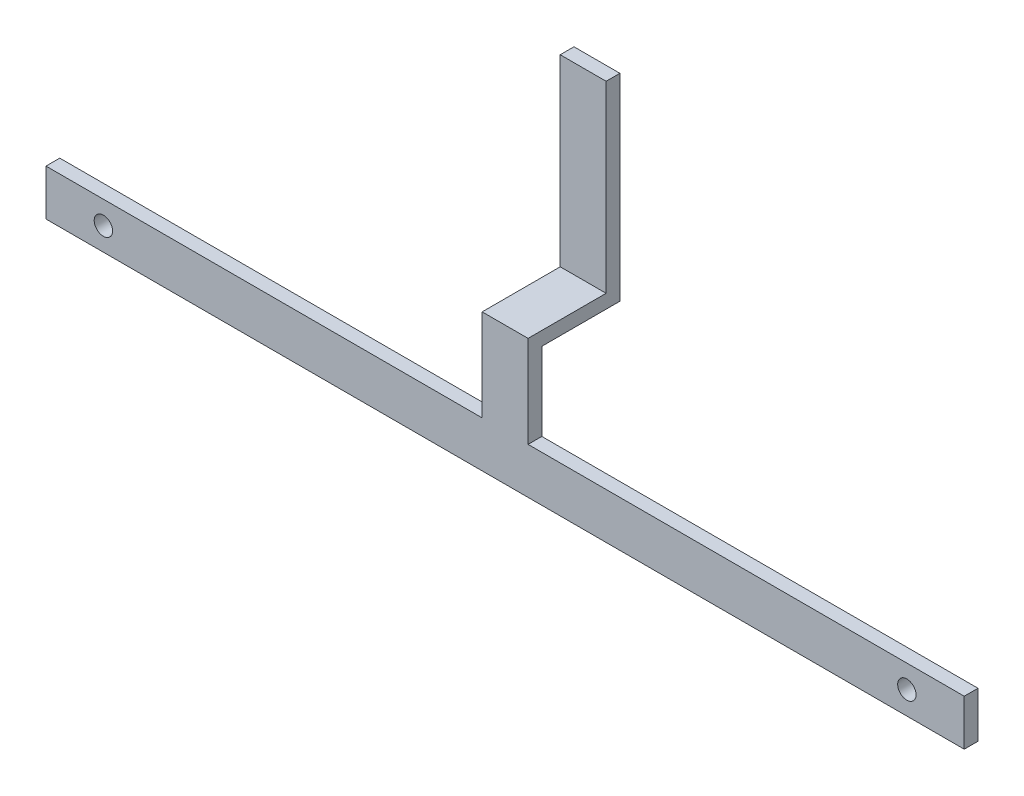
from build123d import *

# Parameters (mm, degrees)
SKETCH1_W           = 200
SKETCH1_H           = 10
SKETCH1_R           = 2
BOSS_EXTRUDE1_DEPTH = 3
SKETCH2_W           = 10
SKETCH2_H           = 20
BOSS_EXTRUDE2_DEPTH = 3
SKETCH3_W           = 10
SKETCH3_H           = 3
BOSS_EXTRUDE3_DEPTH = 17
SKETCH4_W           = 10
SKETCH4_H           = 3
BOSS_EXTRUDE4_DEPTH = 40


with BuildPart() as part:
    # Sketch1 → Boss-Extrude1 (new body)
    with BuildSketch(Plane.XY):
        with Locations((100, -5)):
            Rectangle(SKETCH1_W, SKETCH1_H)
        with Locations((12.5, -5)):
            Circle(SKETCH1_R, mode=Mode.SUBTRACT)
        with Locations((187.5, -5)):
            Circle(SKETCH1_R, mode=Mode.SUBTRACT)
    extrude(amount=BOSS_EXTRUDE1_DEPTH)

    # Sketch2 → Boss-Extrude2 (add)
    with BuildSketch(Plane.XY.offset(3)):
        with Locations((100, 10)):
            Rectangle(SKETCH2_W, SKETCH2_H)
    extrude(amount=-BOSS_EXTRUDE2_DEPTH)

    # Sketch3 → Boss-Extrude3 (add)
    with BuildSketch(Plane(origin=(0, 0, 0), x_dir=(-1, 0, 0), z_dir=(0, 0, -1))):
        with Locations((-100, 18.5)):
            Rectangle(SKETCH3_W, SKETCH3_H)
    extrude(amount=BOSS_EXTRUDE3_DEPTH)

    # Sketch4 → Boss-Extrude4 (add)
    with BuildSketch(Plane(origin=(0, 20, 0), x_dir=(1, 0, 0), z_dir=(0, 1, 0))):
        with Locations((100, 15.5)):
            Rectangle(SKETCH4_W, SKETCH4_H)
    extrude(amount=BOSS_EXTRUDE4_DEPTH)


solid = part.part
